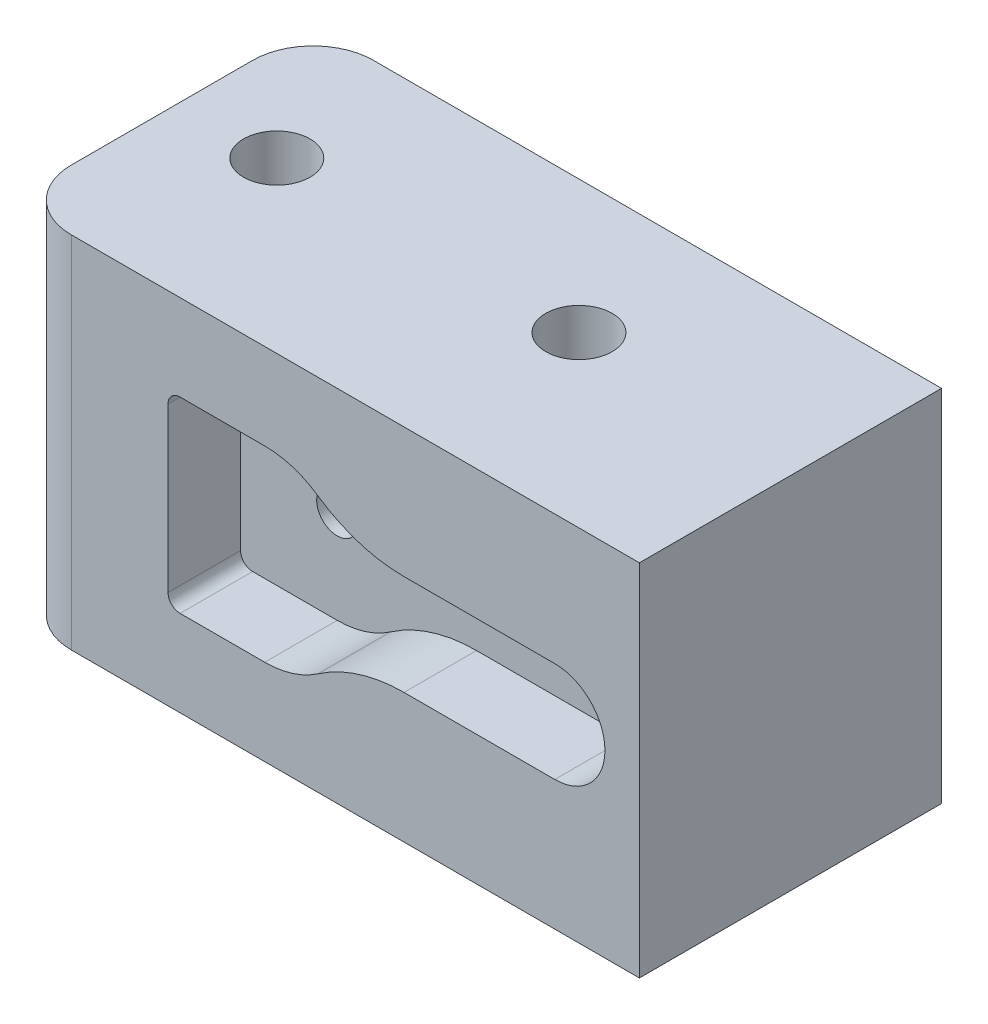
from build123d import *

# Parameters (mm, degrees)
SKETCH1_W           = 52
SKETCH1_H           = 25
BOSS_EXTRUDE1_DEPTH = 29.75
CUT_EXTRUDE1_DEPTH  = 6
CUT_EXTRUDE2_REACH  = 43.44
SKETCH4_R           = 2.75
CUT_EXTRUDE3_REACH  = 45.841
SKETCH5_R           = 1.7
FILLET1_R           = 5
SKETCH6_R           = 3.5
CUT_EXTRUDE4_DEPTH  = 8


with BuildPart() as part:
    # Sketch1 → Boss-Extrude1 (new body)
    with BuildSketch(Plane(origin=(0, 0, 0), x_dir=(1, 0, 0), z_dir=(0, 1, 0))):
        Rectangle(SKETCH1_W, SKETCH1_H)
    extrude(amount=BOSS_EXTRUDE1_DEPTH)

    # Sketch2 → Cut-Extrude1 (cut)
    with BuildSketch(Plane.XY.offset(12.5)):
        with BuildLine():
            Line((19, 19.025), (6.525623627, 19.025))
            ThreePointArc((6.525623627, 19.025), (2.798843665, 19.593482447), (-0.588958859, 21.247222222))
            ThreePointArc((-0.588958859, 21.247222222), (-2.689396423, 22.272540883), (-5, 22.625))
            Line((-5, 22.625), (-12, 22.625))
            ThreePointArc((-12, 22.625), (-12.707106781, 22.332106781), (-13, 21.625))
            Line((-13, 21.625), (-13, 8.125))
            ThreePointArc((-13, 8.125), (-12.707106781, 7.417893219), (-12, 7.125))
            Line((-12, 7.125), (-5, 7.125))
            ThreePointArc((-5, 7.125), (-2.689396423, 7.477459117), (-0.588958859, 8.502777778))
            ThreePointArc((-0.588958859, 8.502777778), (2.798843665, 10.156517553), (6.525623627, 10.725))
            Line((6.525623627, 10.725), (19, 10.725))
            ThreePointArc((19, 10.725), (23.15, 14.875), (19, 19.025))
        make_face()
    extrude(amount=-CUT_EXTRUDE1_DEPTH, mode=Mode.SUBTRACT)

    # Sketch4 → Cut-Extrude2 (cut, up to next)
    with BuildSketch(Plane(origin=(0, 29.75, 0), x_dir=(1, 0, 0), z_dir=(0, 1, 0)), mode=Mode.PRIVATE) as cut_extrude2_sk1:
        with Locations(Location((-18, 1.5, 0), (0, 0, 270))):
            Circle(SKETCH4_R)
    cut_extrude2_tool1 = extrude(cut_extrude2_sk1.sketch, amount=-CUT_EXTRUDE2_REACH, mode=Mode.PRIVATE) & part.part
    # Sketch4 → Cut-Extrude2 (cut, up to next)
    with BuildSketch(Plane(origin=(0, 29.75, 0), x_dir=(1, 0, 0), z_dir=(0, 1, 0)), mode=Mode.PRIVATE) as cut_extrude2_sk2:
        with Locations(Location((7, 1.5, 0), (0, 0, 270))):
            Circle(SKETCH4_R)
    cut_extrude2_tool2 = extrude(cut_extrude2_sk2.sketch, amount=-CUT_EXTRUDE2_REACH, mode=Mode.PRIVATE) & part.part
    add(cut_extrude2_tool1.solids().sort_by_distance((-18, 29.75, -1.5))[0], mode=Mode.SUBTRACT)
    add(cut_extrude2_tool2.solids().sort_by_distance((7, 29.75, -1.5))[0], mode=Mode.SUBTRACT)

    # Sketch5 → Cut-Extrude3 (cut, up to next)
    with BuildSketch(Plane.XY.offset(6.5), mode=Mode.PRIVATE) as cut_extrude3_sk1:
        with Locations((-5, 14.875)):
            Circle(SKETCH5_R)
    cut_extrude3_tool1 = extrude(cut_extrude3_sk1.sketch, amount=-CUT_EXTRUDE3_REACH, mode=Mode.PRIVATE) & part.part
    # Sketch5 → Cut-Extrude3 (cut, up to next)
    with BuildSketch(Plane.XY.offset(6.5), mode=Mode.PRIVATE) as cut_extrude3_sk2:
        with Locations((19, 14.875)):
            Circle(SKETCH5_R)
    cut_extrude3_tool2 = extrude(cut_extrude3_sk2.sketch, amount=-CUT_EXTRUDE3_REACH, mode=Mode.PRIVATE) & part.part
    add(cut_extrude3_tool1.solids().sort_by_distance((-5, 14.875, 6.5))[0], mode=Mode.SUBTRACT)
    add(cut_extrude3_tool2.solids().sort_by_distance((19, 14.875, 6.5))[0], mode=Mode.SUBTRACT)

    # Fillet1
    fillet1_edges = [part.edges().sort_by_distance(p)[0] for p in [
        (-26, 14.875, 12.5),
        (-26, 14.875, -12.5),
    ]]
    fillet(fillet1_edges, radius=FILLET1_R)

    # Sketch6 → Cut-Extrude4 (cut)
    with BuildSketch(Plane(origin=(0, 0, -12.5), x_dir=(-1, 0, 0), z_dir=(0, 0, -1))):
        with Locations((-19, 14.875)):
            Circle(SKETCH6_R)
        with Locations((5, 14.875)):
            Circle(SKETCH6_R)
    extrude(amount=-CUT_EXTRUDE4_DEPTH, mode=Mode.SUBTRACT)


solid = part.part
